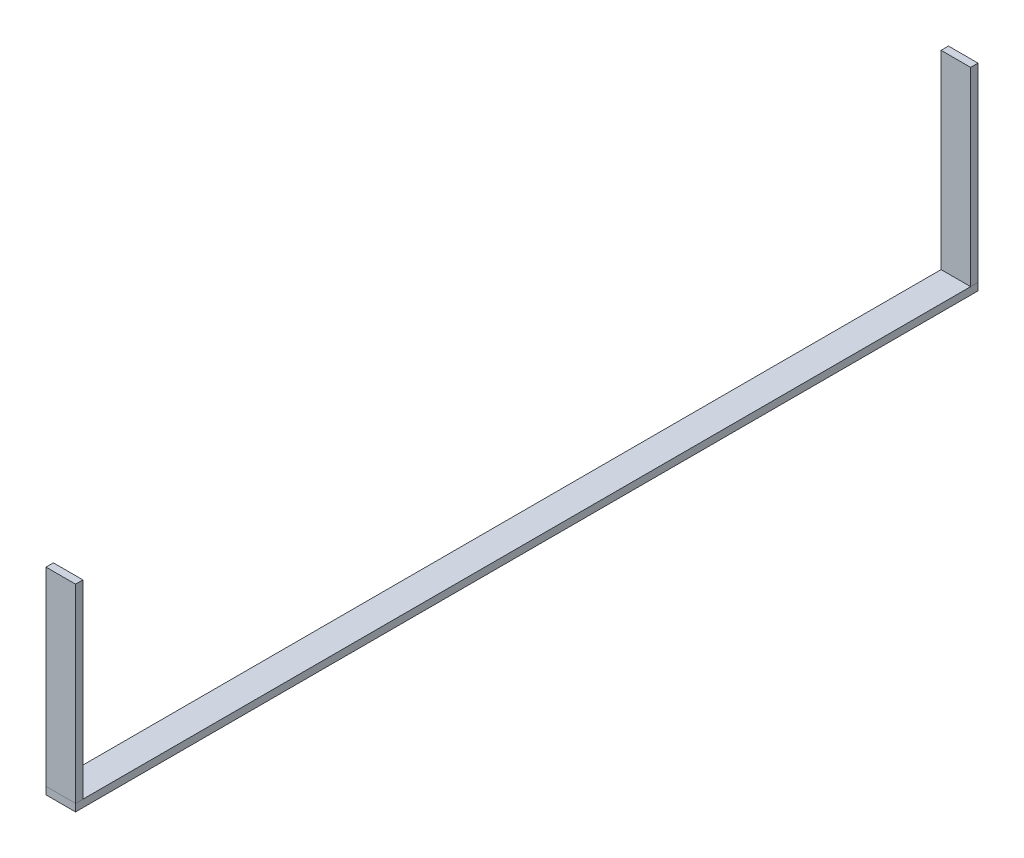
from build123d import *

# Parameters (mm, degrees)
SKETCH1_W             = 12.7
SKETCH1_H             = 388
BOSS_EXTRUDE1_DEPTH   = 3.175
SKETCH2_W             = 12.7
SKETCH2_H             = 3.175
BOSS_EXTRUDE2_DEPTH   = 81.65
BOSS_EXTRUDE2_2_DEPTH = 81.65


with BuildPart() as part:
    # Sketch1 → Boss-Extrude1 (new body)
    with BuildSketch(Plane(origin=(0, 0, 0), x_dir=(1, 0, 0), z_dir=(0, 1, 0))):
        Rectangle(SKETCH1_W, SKETCH1_H)
    extrude(amount=BOSS_EXTRUDE1_DEPTH)


with BuildPart() as body_2:
    # Sketch2 → Boss-Extrude2 (new body)
    with BuildSketch(Plane(origin=(0, 3.175, 0), x_dir=(1, 0, 0), z_dir=(0, 1, 0))):
        with Locations((0, -192.4125)):
            Rectangle(SKETCH2_W, SKETCH2_H)
    extrude(amount=BOSS_EXTRUDE2_DEPTH)


with BuildPart() as body_3:
    # Sketch2 → Boss-Extrude2 2 (new body)
    with BuildSketch(Plane(origin=(0, 3.175, 0), x_dir=(1, 0, 0), z_dir=(0, 1, 0))):
        with Locations((0, 192.4125)):
            Rectangle(SKETCH2_W, SKETCH2_H)
    extrude(amount=BOSS_EXTRUDE2_2_DEPTH)


solid = Compound([part.part, body_2.part, body_3.part])
